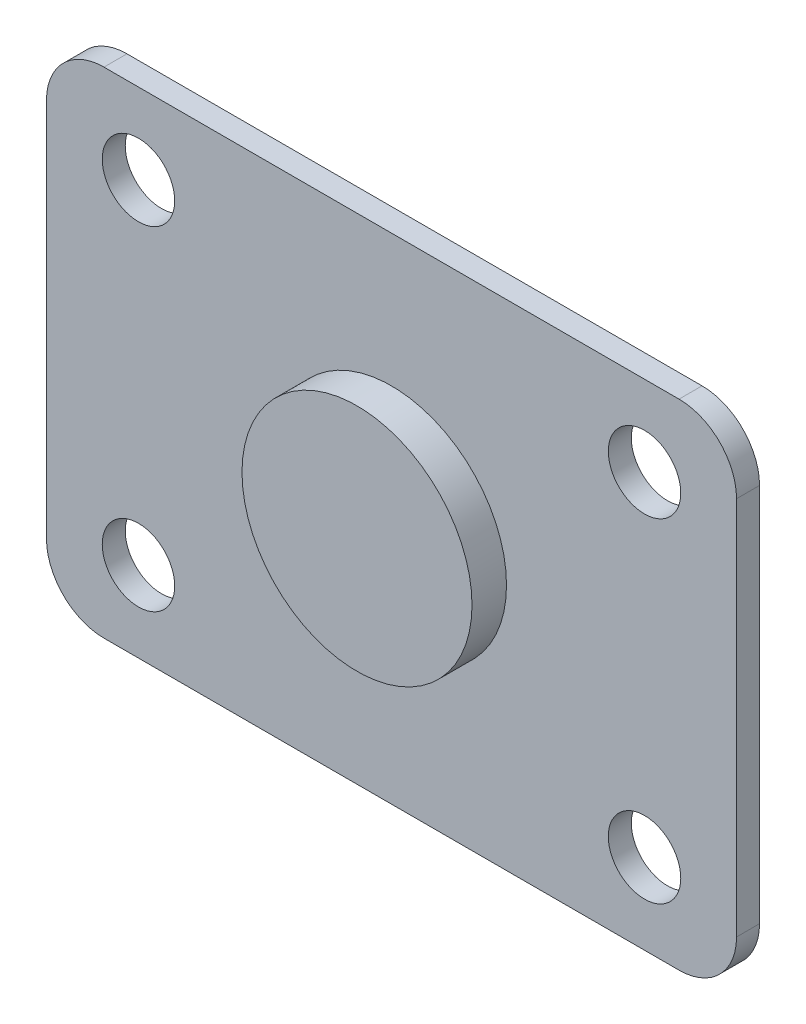
from build123d import *

# Parameters (mm, degrees)
SKETCH_1_W          = 60
SKETCH_1_H          = 43
EXTRUDE_1_DEPTH     = 2
SKETCH_2_R          = 10
EXTRUDE_2_DEPTH     = 3
FILLET_1_R          = 5
SKETCH_3_R          = 3.15
CUT_EXTRUDE_1_DEPTH = 3


with BuildPart() as part:
    # 草图1 → 凸台-拉伸1 (new body)
    with BuildSketch(Plane.XY):
        Rectangle(SKETCH_1_W, SKETCH_1_H)
    extrude(amount=EXTRUDE_1_DEPTH)

    # 草图2 → 凸台-拉伸2 (add)
    with BuildSketch(Plane.XY.offset(2)):
        Circle(SKETCH_2_R)
    extrude(amount=EXTRUDE_2_DEPTH)

    # 圆角1
    fillet_1_edges = [part.edges().sort_by_distance(p)[0] for p in [
        (-30, 21.5, 1),
        (30, 21.5, 1),
        (30, -21.5, 1),
        (-30, -21.5, 1),
    ]]
    fillet(fillet_1_edges, radius=FILLET_1_R)

    # 草图3 → 切除-拉伸1 (cut)
    with BuildSketch(Plane(origin=(0, 0, 0), x_dir=(-1, 0, 0), z_dir=(0, 0, -1))):
        with Locations((22, 14.5)):
            Circle(SKETCH_3_R)
        with Locations((22, -14.5)):
            Circle(SKETCH_3_R)
        with Locations((-22, 14.5)):
            Circle(SKETCH_3_R)
        with Locations((-22, -14.5)):
            Circle(SKETCH_3_R)
    extrude(amount=-CUT_EXTRUDE_1_DEPTH, mode=Mode.SUBTRACT)


solid = part.part
